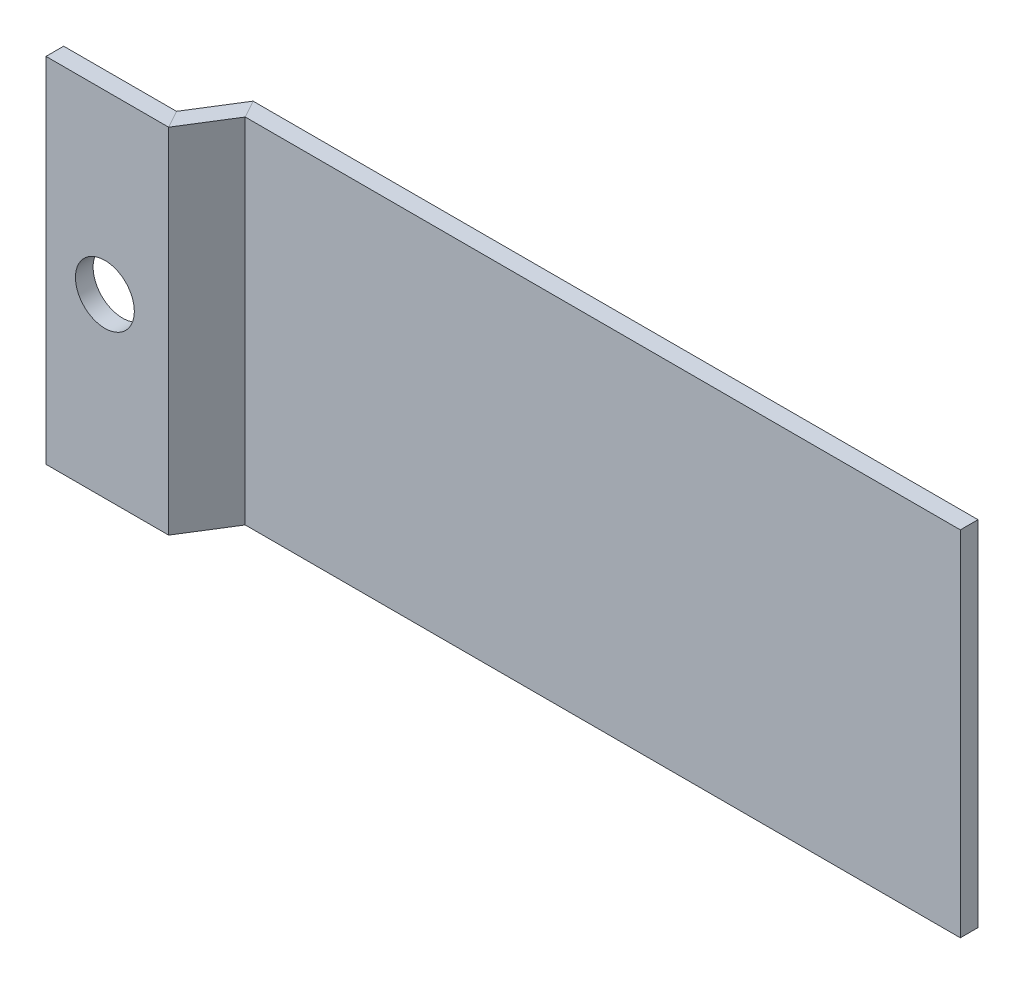
from build123d import *

# Parameters (mm, degrees)
SKETCH2_W          = 0.6
SKETCH2_H          = 12
SKETCH3_R          = 1
CUT_EXTRUDE1_DEPTH = 10


with BuildPart() as part:
    # Sweep1: sweep along a path in Sketch1
    with BuildLine(Plane(origin=(0, 0, 0), x_dir=(1, 0, 0), z_dir=(0, 1, 0))) as sweep1_path:
        Line((0, 0), (4, 0))
        Line((4, 0), (5, 1.6))
        Line((5, 1.6), (29.454736631, 1.6))
    # Sketch2 → Sweep1 (sweep)
    with BuildSketch(Plane(origin=(0, 0, 0), x_dir=(0, 0, -1), z_dir=(1, 0, 0))):
        Rectangle(SKETCH2_W, SKETCH2_H)
    sweep(path=sweep1_path.line, transition=Transition.RIGHT)

    # Sketch3 → Cut-Extrude1 (cut)
    with BuildSketch(Plane(origin=(0, 0, -0.3), x_dir=(-1, 0, 0), z_dir=(0, 0, -1))):
        with Locations(Location((-2, 0, 0), (0, 0, 90))):
            Circle(SKETCH3_R)
    extrude(amount=-CUT_EXTRUDE1_DEPTH, mode=Mode.SUBTRACT)


solid = part.part
